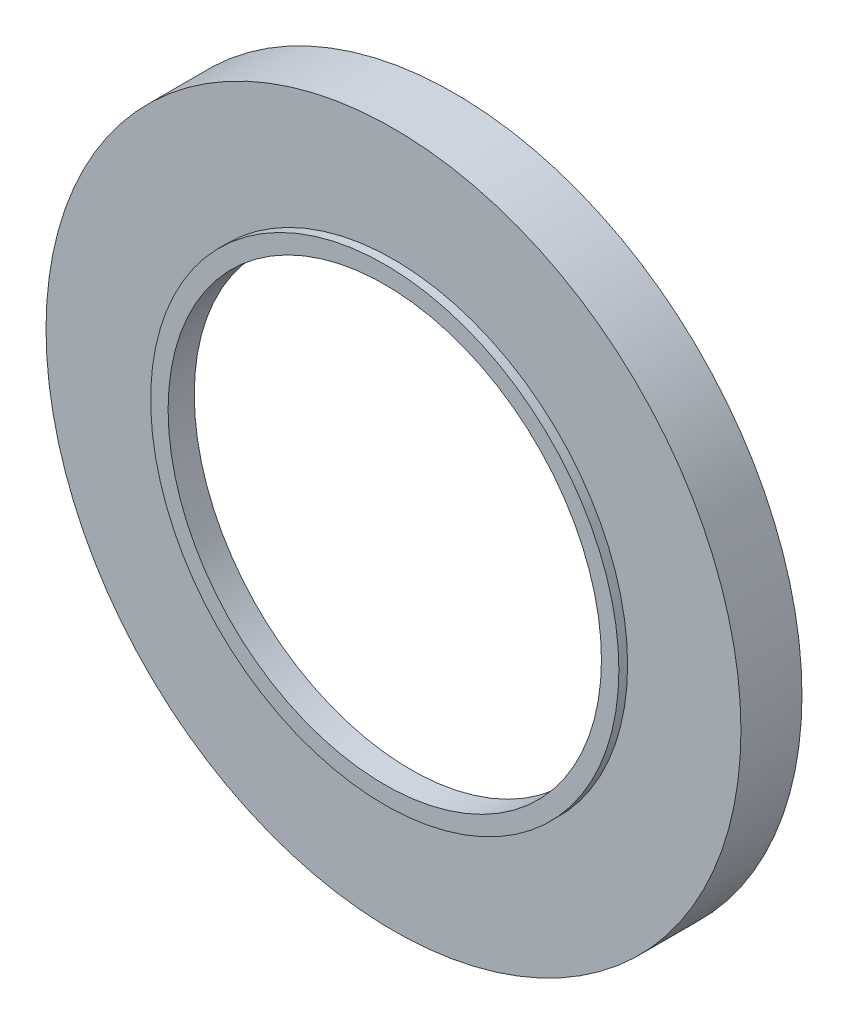
from build123d import *

# Parameters (mm, degrees)
SKETCH_1_R      = 39.851335376
SKETCH_1_R_2    = 37.851335376
EXTRUDE_1_DEPTH = 5
SKETCH_2_R      = 39.851335376
SKETCH_2_R_2    = 24.851335376
EXTRUDE_2_DEPTH = 2
SKETCH_3_R      = 26.851335376
SKETCH_3_R_2    = 24.851335376
EXTRUDE_3_DEPTH = 1


with BuildPart() as part:
    # 草图1 → 拉伸-薄壁1 (new body)
    with BuildSketch(Plane.XY):
        Circle(SKETCH_1_R)
        Circle(SKETCH_1_R_2, mode=Mode.SUBTRACT)
    extrude(amount=EXTRUDE_1_DEPTH)

    # 草图2 → 拉伸-薄壁2 (add)
    with BuildSketch(Plane.XY.offset(5)):
        Circle(SKETCH_2_R)
        Circle(SKETCH_2_R_2, mode=Mode.SUBTRACT)
    extrude(amount=EXTRUDE_2_DEPTH)

    # 草图3 → 拉伸-薄壁3 (add)
    with BuildSketch(Plane.XY.offset(7)):
        Circle(SKETCH_3_R)
        Circle(SKETCH_3_R_2, mode=Mode.SUBTRACT)
    extrude(amount=EXTRUDE_3_DEPTH)


solid = part.part
